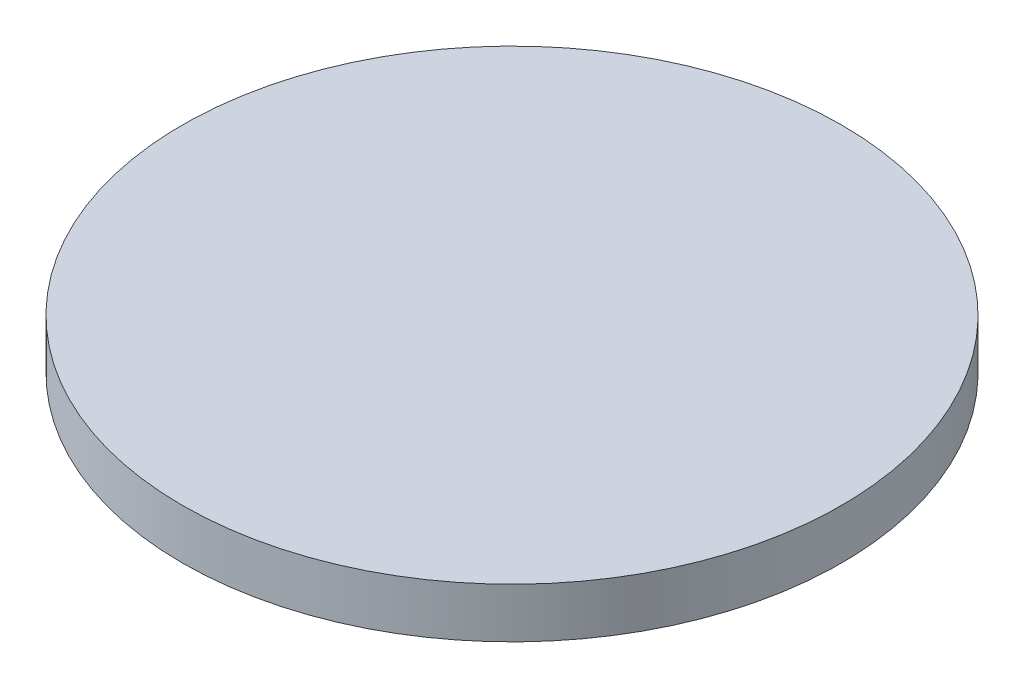
from build123d import *

# Parameters (mm, degrees)
CROQUIS1_R              = 33
SALIENTE_EXTRUIR1_DEPTH = 5


with BuildPart() as part:
    # Croquis1 → Saliente-Extruir1 (new body)
    with BuildSketch(Plane(origin=(0, 0, 0), x_dir=(1, 0, 0), z_dir=(0, 1, 0))):
        with Locations(Location((0, 0, 0), (0, 0, 270))):
            Circle(CROQUIS1_R)
    extrude(amount=SALIENTE_EXTRUIR1_DEPTH)


solid = part.part
